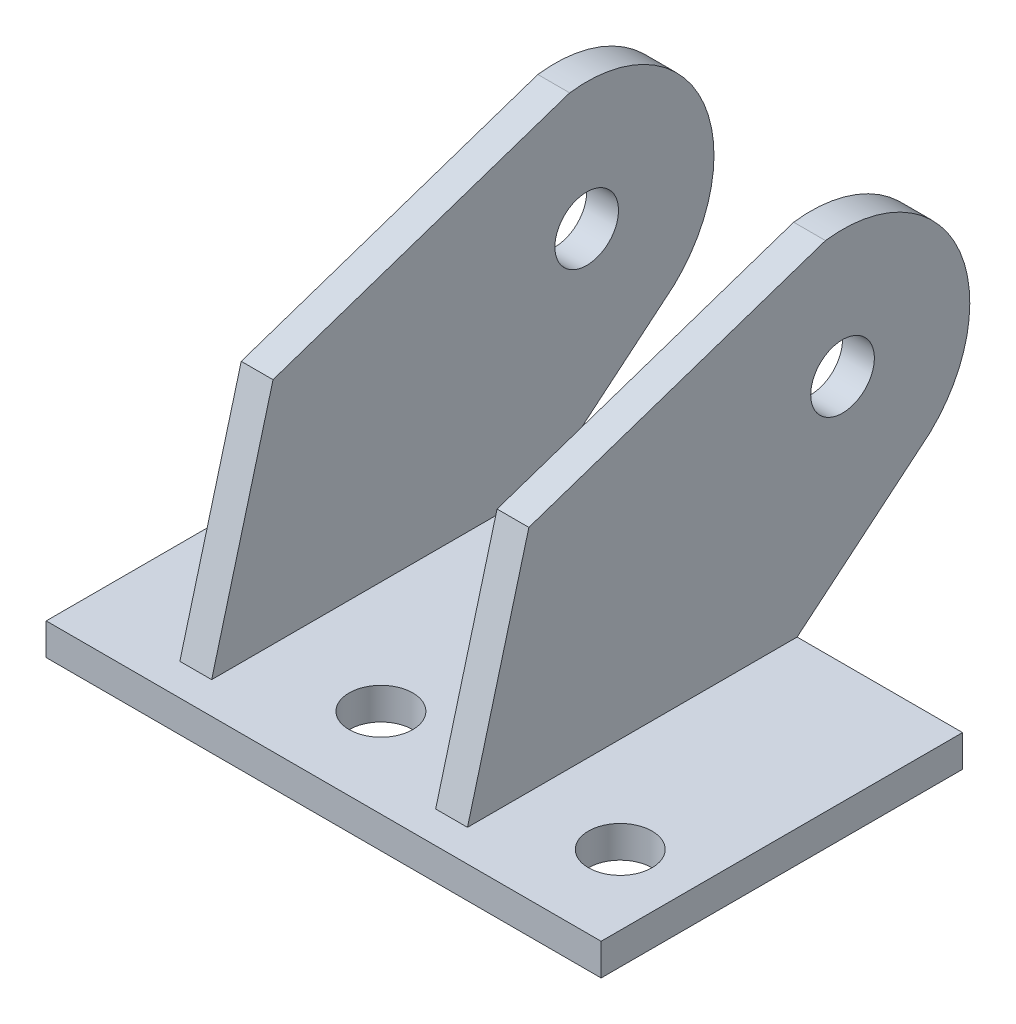
from build123d import *

# Parameters (mm, degrees)
SKETCH1_W           = 55.372
SKETCH1_H           = 36.068
SKETCH1_R           = 3.175
BOSS_EXTRUDE1_DEPTH = 3.175
SKETCH2_W           = 3.175
SKETCH2_H           = 50.8
BOSS_EXTRUDE2_DEPTH = 38.1
CUT_EXTRUDE1_REACH  = 83.615
SKETCH3_R           = 3.175
CUT_EXTRUDE2_DEPTH  = 82.615263242


with BuildPart() as part:
    # Sketch1 → Boss-Extrude1 (new body)
    with BuildSketch(Plane(origin=(0, 0, 0), x_dir=(1, 0, 0), z_dir=(0, 1, 0))):
        with Locations((27.686, 18.034)):
            Rectangle(SKETCH1_W, SKETCH1_H)
        with Locations(Location((24.511, 8.89, 0), (0, 0, 270))):
            Circle(SKETCH1_R, mode=Mode.SUBTRACT)
        with Locations(Location((24.511, 26.162, 0), (0, 0, 270))):
            Circle(SKETCH1_R, mode=Mode.SUBTRACT)
        with Locations(Location((48.387, 8.89, 0), (0, 0, 270))):
            Circle(SKETCH1_R, mode=Mode.SUBTRACT)
    extrude(amount=BOSS_EXTRUDE1_DEPTH)

    # Sketch2 → Boss-Extrude2 (add)
    with BuildSketch(Plane(origin=(0, 3.175, 0), x_dir=(1, 0, 0), z_dir=(0, 1, 0))):
        with Locations((11.7475, 28.575)):
            Rectangle(SKETCH2_W, SKETCH2_H)
        with Locations((37.2745, 28.575)):
            Rectangle(SKETCH2_W, SKETCH2_H)
    extrude(amount=BOSS_EXTRUDE2_DEPTH)

    # Cut-Extrude1: up to this face of the body (flat: up to its plane)
    cut_extrude1_end = Plane(part.part.faces().sort_by_distance((38.862, 22.225, -28.575))[0])
    # Sketch3 → Cut-Extrude1 (cut, up to the picked face)
    with BuildSketch(Plane.ZY.offset(-10.16), mode=Mode.PRIVATE) as cut_extrude1_sk1:
        with Locations((-40.597508243, 23.435544859)):
            Circle(SKETCH3_R)
    cut_extrude1_tool1 = split(extrude(cut_extrude1_sk1.sketch, amount=-CUT_EXTRUDE1_REACH, mode=Mode.PRIVATE), bisect_by=cut_extrude1_end, keep=Keep.BOTH, mode=Mode.PRIVATE)
    add(cut_extrude1_tool1.solids().sort_by(Axis((10.16, 23.435545, -40.597508), (1, 0, 0)))[0], mode=Mode.SUBTRACT)

    # Sketch4 → Cut-Extrude2 (cut, through all)
    with BuildSketch(Plane.ZY.offset(-10.16)):
        with BuildLine():
            Line((-3.175, 3.175), (-3.175, 41.275))
            Line((-3.175, 41.275), (-53.975, 41.275))
            Line((-53.975, 41.275), (-53.975, 3.175))
            Line((-53.975, 3.175), (-36.068, 3.175))
            Line((-36.068, 3.175), (-49.342170052, 14.225719136))
            ThreePointArc((-49.342170052, 14.225719136), (-52.050540003, 28.923537523), (-38.898272892, 36.021354297))
            Line((-38.898272892, 36.021354297), (-9.300318539, 26.035))
            Line((-9.300318539, 26.035), (-3.175, 3.175))
        make_face()
    extrude(amount=-CUT_EXTRUDE2_DEPTH, mode=Mode.SUBTRACT)


solid = part.part
